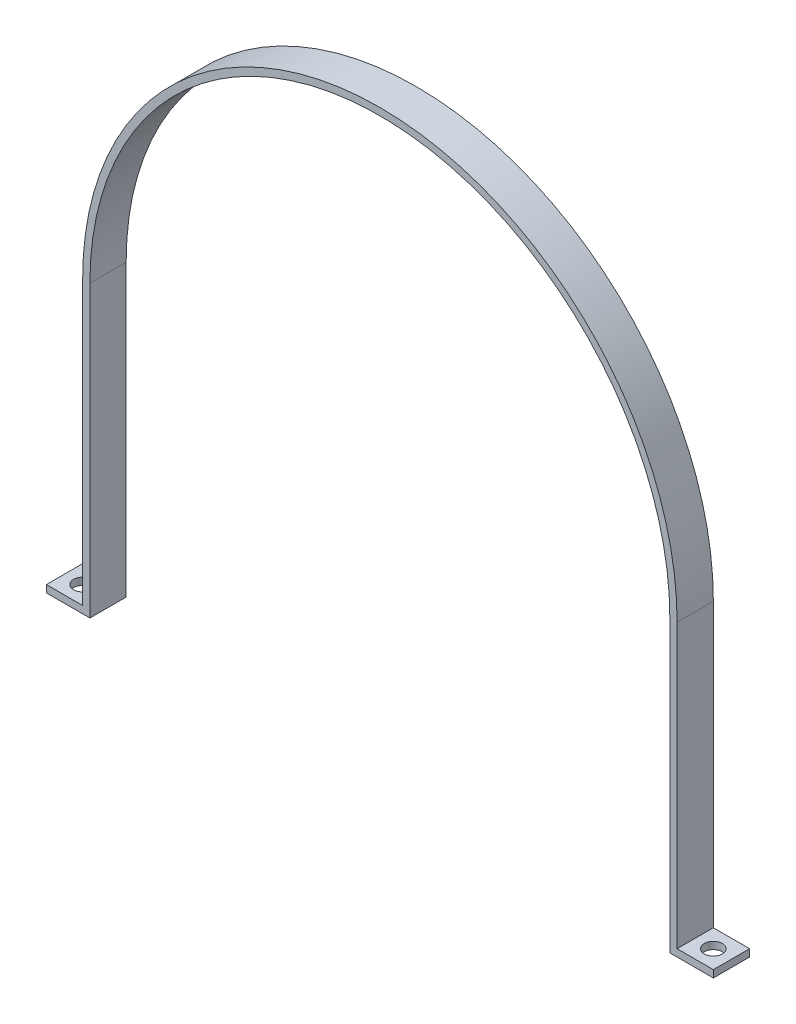
from build123d import *

# Parameters (mm, degrees)
Y_KSEKLIK_EKSTR_ZYON2_DEPTH = 10
IZIM2_R                     = 2.5
KES_EKSTR_ZYON1_DEPTH       = 2


with BuildPart() as part:
    # Çizim1 → Yükseklik-Ekstrüzyon2 (new body)
    with BuildSketch(Plane.XY):
        with BuildLine():
            Line((-80, 0), (-80, -80))
            Line((-80, -80), (-92, -80))
            Line((-92, -80), (-92, -78))
            Line((-92, -78), (-82, -78))
            Line((-82, -78), (-82, 0))
            ThreePointArc((-82, 0), (0, 82), (82, 0))
            Line((82, 0), (82, -78))
            Line((82, -78), (92, -78))
            Line((92, -78), (92, -80))
            Line((92, -80), (80, -80))
            Line((80, -80), (80, 0))
            ThreePointArc((80, 0), (0, 80), (-80, 0))
        make_face()
    extrude(amount=Y_KSEKLIK_EKSTR_ZYON2_DEPTH)

    # Çizim2 → Kes-Ekstrüzyon1 (cut)
    with BuildSketch(Plane.XZ.offset(80)):
        with Locations(Location((87, 5, 0), (0, 0, 270))):
            Circle(IZIM2_R)
        with Locations(Location((-87, 5, 0), (0, 0, 90))):
            Circle(IZIM2_R)
    extrude(amount=-KES_EKSTR_ZYON1_DEPTH, mode=Mode.SUBTRACT)


solid = part.part
